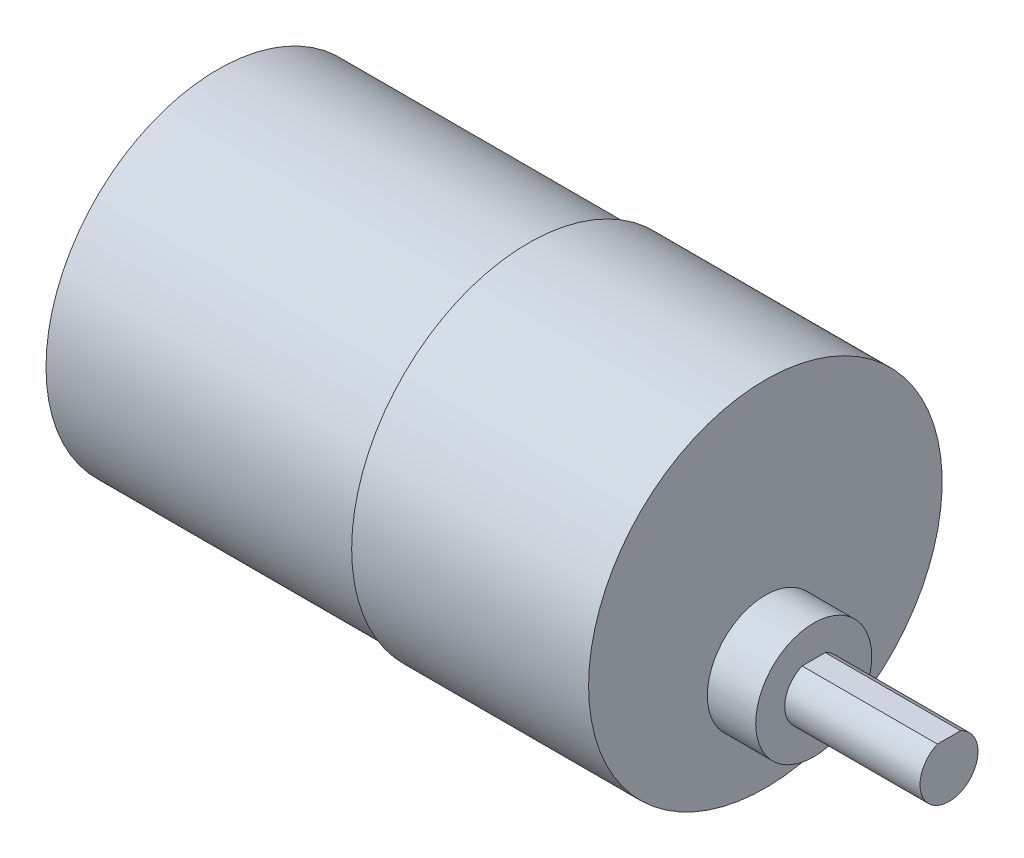
from build123d import *

# Parameters (mm, degrees)
SKETCH2_R           = 6.0000007
BOSS_EXTRUDE1_DEPTH = 4.99999
BOSS_EXTRUDE2_DEPTH = 13.9999974


with BuildPart() as part:
    # Sketch1 → Revolve1 (revolve)
    with BuildSketch(Plane.XY, mode=Mode.PRIVATE) as revolve1_sk:
        Polygon((28.321, 0), (28.321, 18.288), (3.80803947, 18.288), (3.80803947, 17.78), (-28.321, 17.78), (-28.321, 0), align=None)
    revolve(revolve1_sk.sketch.rotate(Axis((-37.449530368, 0, 0), (1, 0, 0)), 90), axis=Axis((-37.449530368, 0, 0), (1, 0, 0)))

    # Sketch2 → Boss-Extrude1 (add)
    with BuildSketch(Plane(origin=(28.321, 0, 0), x_dir=(0, 0, -1), z_dir=(1, 0, 0))):
        with Locations(Location((0, -7.00024, 0), (0, 0, 180))):
            Circle(SKETCH2_R)
    extrude(amount=BOSS_EXTRUDE1_DEPTH)

    # Sketch3 → Boss-Extrude2 (add)
    with BuildSketch(Plane(origin=(33.32099, 0, 0), x_dir=(0, 0, -1), z_dir=(1, 0, 0))):
        with BuildLine():
            Line((-1.198955483, -4.2502455), (1.198955483, -4.2502455))
            ThreePointArc((1.198955483, -4.2502455), (0, -10.000234), (-1.198955483, -4.2502455))
        make_face()
    extrude(amount=BOSS_EXTRUDE2_DEPTH)


solid = part.part
